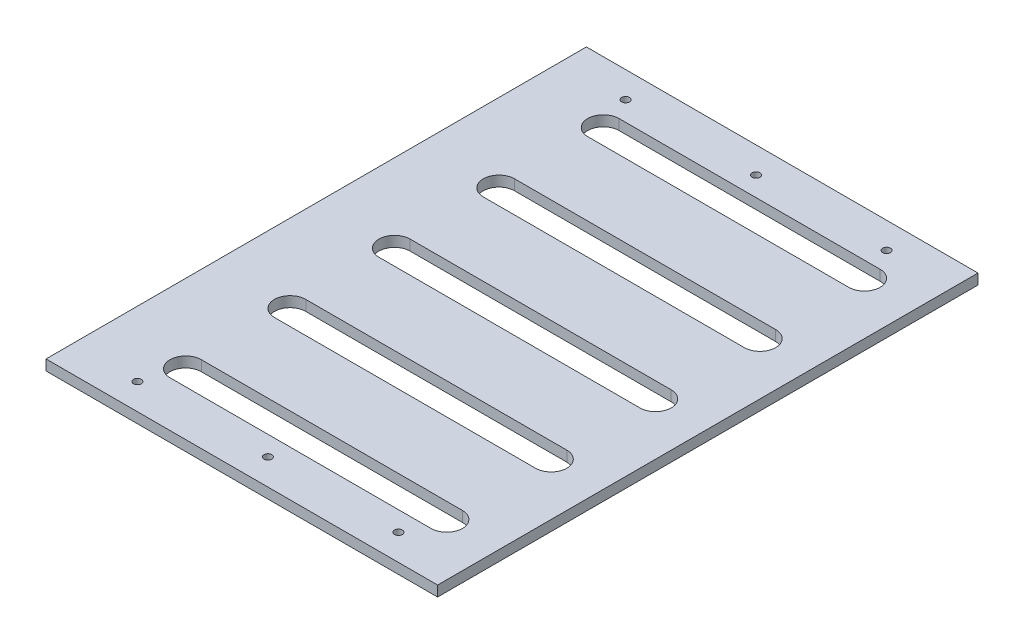
from build123d import *

# Parameters (mm, degrees)
SKETCH_1_W          = 150
SKETCH_1_H          = 207
EXTRUDE_1_DEPTH     = 4
CUT_EXTRUDE_1_DEPTH = 256.665797478
SKETCH_3_R          = 1.5
CUT_EXTRUDE_2_DEPTH = 256.665797478


with BuildPart() as part:
    # 草图1 → 凸台-拉伸1 (new body)
    with BuildSketch(Plane(origin=(0, 0, 0), x_dir=(1, 0, 0), z_dir=(0, 1, 0))):
        with Locations((75, 103.5)):
            Rectangle(SKETCH_1_W, SKETCH_1_H)
    extrude(amount=EXTRUDE_1_DEPTH)

    # 草图2 → 切除-拉伸1 (cut, through all)
    with BuildSketch(Plane(origin=(0, 4, 0), x_dir=(1, 0, 0), z_dir=(0, 1, 0))):
        with BuildLine():
            Line((30, 189.5), (130, 189.5))
            ThreePointArc((130, 189.5), (136, 183.5), (130, 177.5))
            Line((130, 177.5), (30, 177.5))
            ThreePointArc((30, 177.5), (24, 183.5), (30, 189.5))
        make_face()
        with BuildLine():
            Line((30, 149.5), (130, 149.5))
            ThreePointArc((130, 149.5), (136, 143.5), (130, 137.5))
            Line((130, 137.5), (30, 137.5))
            ThreePointArc((30, 137.5), (24, 143.5), (30, 149.5))
        make_face()
        with BuildLine():
            Line((30, 97.5), (130, 97.5))
            ThreePointArc((130, 97.5), (136, 103.5), (130, 109.5))
            Line((130, 109.5), (30, 109.5))
            ThreePointArc((30, 109.5), (24, 103.5), (30, 97.5))
        make_face()
        with BuildLine():
            Line((30, 57.5), (130, 57.5))
            ThreePointArc((130, 57.5), (136, 63.5), (130, 69.5))
            Line((130, 69.5), (30, 69.5))
            ThreePointArc((30, 69.5), (24, 63.5), (30, 57.5))
        make_face()
        with BuildLine():
            Line((30, 17.5), (130, 17.5))
            ThreePointArc((130, 17.5), (136, 23.5), (130, 29.5))
            Line((130, 29.5), (30, 29.5))
            ThreePointArc((30, 29.5), (24, 23.5), (30, 17.5))
        make_face()
    extrude(amount=-CUT_EXTRUDE_1_DEPTH, mode=Mode.SUBTRACT)

    # 草图3 → 切除-拉伸2 (cut, through all)
    with BuildSketch(Plane(origin=(0, 4, 0), x_dir=(1, 0, 0), z_dir=(0, 1, 0))):
        with Locations(Location((125, 197, 0), (0, 0, 270))):
            Circle(SKETCH_3_R)
        with Locations(Location((75, 197, 0), (0, 0, 270))):
            Circle(SKETCH_3_R)
        with Locations(Location((25, 197, 0), (0, 0, 270))):
            Circle(SKETCH_3_R)
        with Locations(Location((25, 10, 0), (0, 0, 90))):
            Circle(SKETCH_3_R)
        with Locations(Location((75, 10, 0), (0, 0, 90))):
            Circle(SKETCH_3_R)
        with Locations(Location((125, 10, 0), (0, 0, 90))):
            Circle(SKETCH_3_R)
    extrude(amount=-CUT_EXTRUDE_2_DEPTH, mode=Mode.SUBTRACT)


solid = part.part
